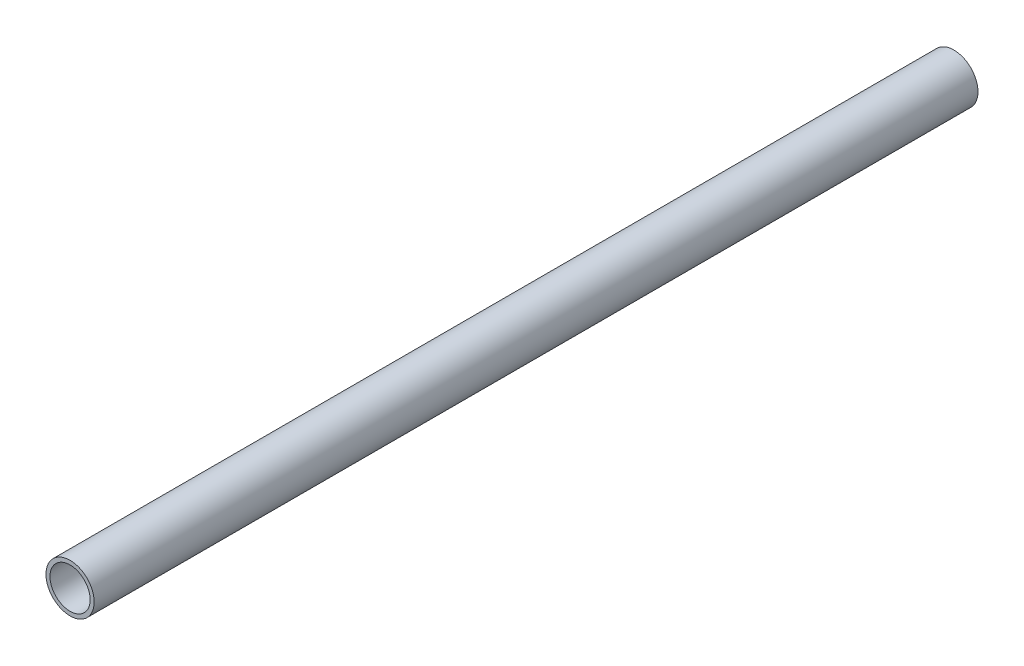
from build123d import *

# Parameters (mm, degrees)
SKETCH1_R           = 6
SKETCH1_R_2         = 5
BOSS_EXTRUDE1_DEPTH = 220


with BuildPart() as part:
    # Sketch1 → Boss-Extrude1 (new body)
    with BuildSketch(Plane.XY):
        Circle(SKETCH1_R)
        Circle(SKETCH1_R_2, mode=Mode.SUBTRACT)
    extrude(amount=BOSS_EXTRUDE1_DEPTH)


solid = part.part
